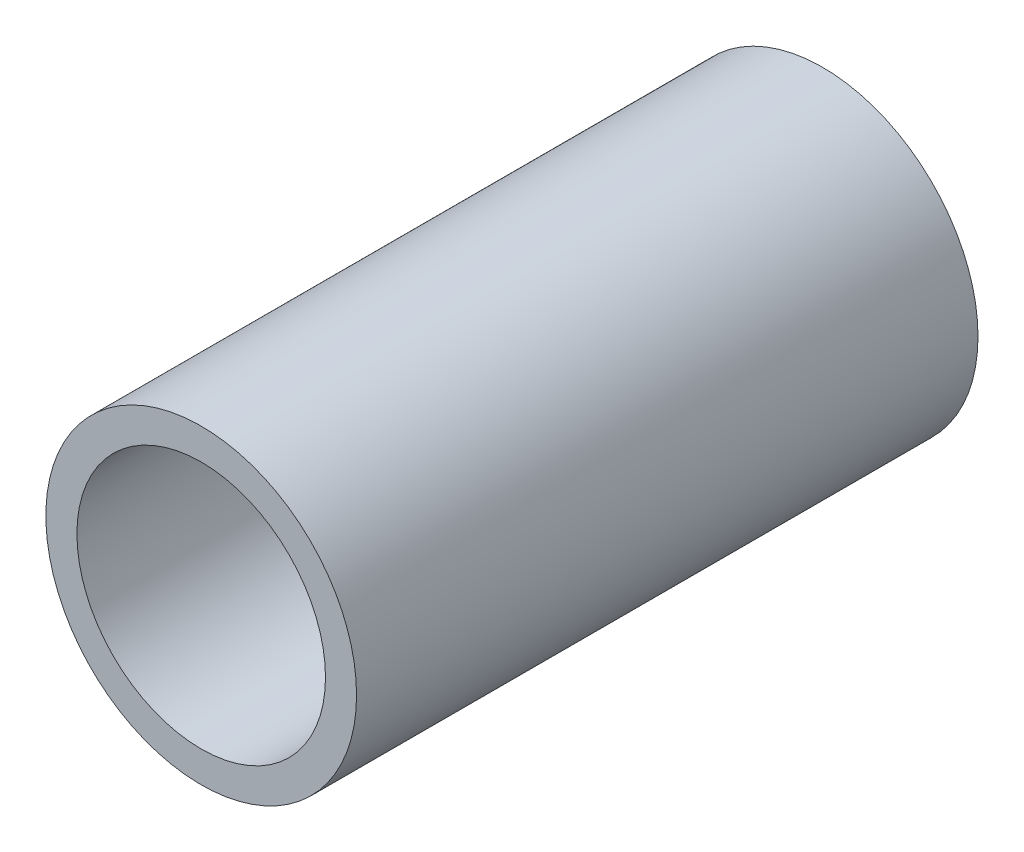
from build123d import *

# Parameters (mm, degrees)
SKETCH1_R           = 7.9375
SKETCH1_R_2         = 6.35
BOSS_EXTRUDE1_DEPTH = 31.75


with BuildPart() as part:
    # Sketch1 → Boss-Extrude1 (new body)
    with BuildSketch(Plane.XY):
        Circle(SKETCH1_R)
        Circle(SKETCH1_R_2, mode=Mode.SUBTRACT)
    extrude(amount=BOSS_EXTRUDE1_DEPTH)


solid = part.part
